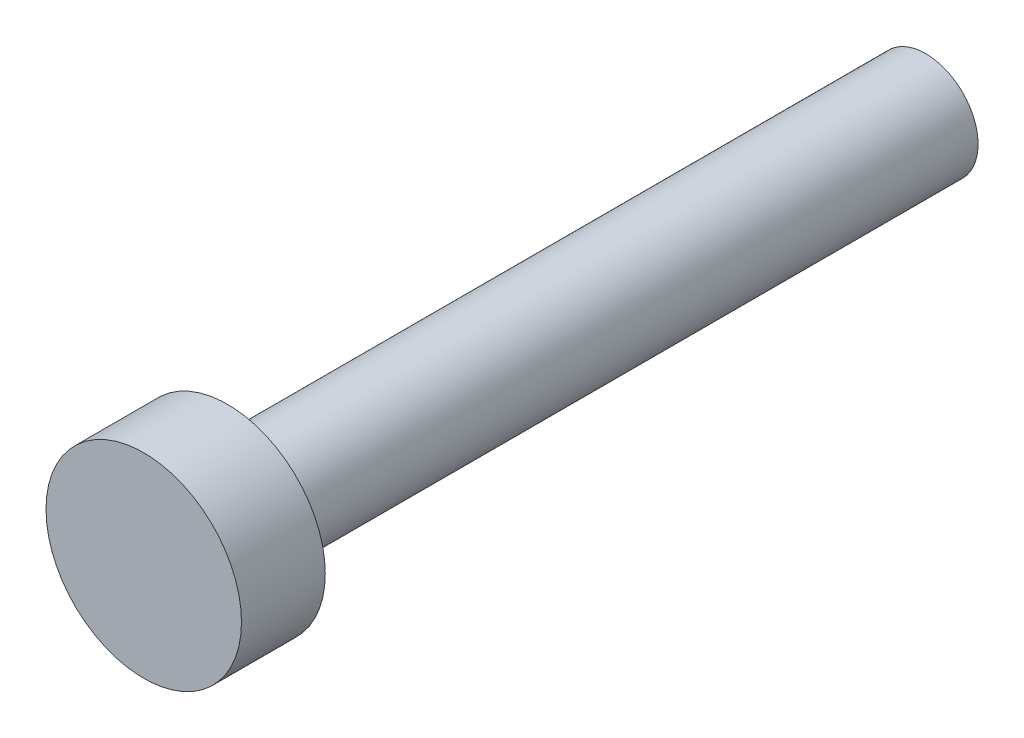
from build123d import *

# Parameters (mm, degrees)
ESQUISSE1_R        = 2.8
BOSS_EXTRU_1_DEPTH = 2.4
ESQUISSE2_R        = 1.5
BOSS_EXTRU_2_DEPTH = 20


with BuildPart() as part:
    # Esquisse1 → Boss.-Extru.1 (new body)
    with BuildSketch(Plane.XY):
        Circle(ESQUISSE1_R)
    extrude(amount=BOSS_EXTRU_1_DEPTH)

    # Esquisse2 → Boss.-Extru.2 (add)
    with BuildSketch(Plane(origin=(0, 0, 0), x_dir=(-1, 0, 0), z_dir=(0, 0, -1))):
        Circle(ESQUISSE2_R)
    extrude(amount=BOSS_EXTRU_2_DEPTH)


solid = part.part
